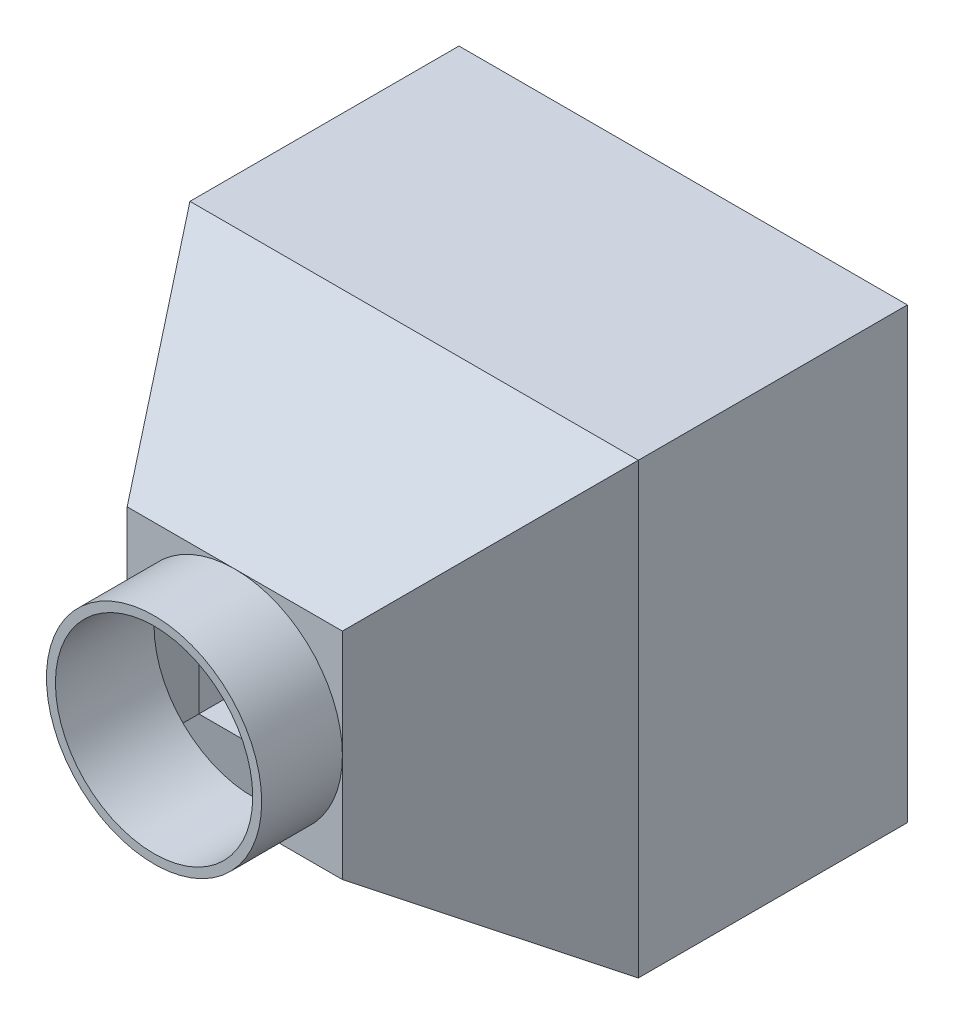
from build123d import *

# Parameters (mm, degrees)
SKETCH_1_W           = 50
SKETCH_1_H           = 50
EXTRUDE_1_DEPTH      = 50
SKETCH_6_R           = 12
SKETCH_6_R_2         = 11
EXTRUDE_3_DEPTH      = 9
CUT_EXTRUDE_5_REACH  = 83.277
CUT_EXTRUDE_6_REACH  = 83.277
SKETCH_20_W          = 48
SKETCH_20_H          = 48
CUT_EXTRUDE_7_DEPTH  = 30
CUT_EXTRUDE_START    = -29
SKETCH_21_R          = 11
CUT_EXTRUDE_9_DEPTH  = 29
SKETCH_28_W          = 48
SKETCH_28_H          = 48
CUT_EXTRUDE_11_DEPTH = 18
CUT_EXTRUDE_11_DRAFT = -33


with BuildPart() as part:
    # Эскиз1 → Бобышка-Вытянуть1 (new body)
    with BuildSketch(Plane.XY):
        Rectangle(SKETCH_1_W, SKETCH_1_H)
    extrude(amount=EXTRUDE_1_DEPTH)

    # Эскиз6 → Бобышка-Вытянуть3 (add)
    with BuildSketch(Plane.XY.offset(50)):
        Circle(SKETCH_6_R)
        Circle(SKETCH_6_R_2, mode=Mode.SUBTRACT)
    extrude(amount=EXTRUDE_3_DEPTH)

    # Вырез-Вытянуть5: up to this face of the body (flat: up to its plane)
    cut_extrude_5_end = Plane(part.part.faces().sort_by_distance((0, 25, 25))[0])
    # Эскиз19 → Вырез-Вытянуть5 (cut, up to the picked face)
    with BuildSketch(Plane.XZ.offset(25), mode=Mode.PRIVATE) as cut_extrude_5_sk1:
        Polygon((-12, 50), (-25, 50), (-25, 30), align=None)
    cut_extrude_5_tool1 = split(extrude(cut_extrude_5_sk1.sketch, amount=-CUT_EXTRUDE_5_REACH, mode=Mode.PRIVATE), bisect_by=cut_extrude_5_end, keep=Keep.BOTH, mode=Mode.PRIVATE)
    # Эскиз19 → Вырез-Вытянуть5 (cut, up to the picked face)
    with BuildSketch(Plane.XZ.offset(25), mode=Mode.PRIVATE) as cut_extrude_5_sk2:
        Polygon((12, 50), (25, 50), (25, 30), align=None)
    cut_extrude_5_tool2 = split(extrude(cut_extrude_5_sk2.sketch, amount=-CUT_EXTRUDE_5_REACH, mode=Mode.PRIVATE), bisect_by=cut_extrude_5_end, keep=Keep.BOTH, mode=Mode.PRIVATE)
    add(cut_extrude_5_tool1.solids().sort_by(Axis((-20.666667, -25, 43.333333), (0, 1, 0)))[0], mode=Mode.SUBTRACT)
    add(cut_extrude_5_tool2.solids().sort_by(Axis((20.666667, -25, 43.333333), (0, 1, 0)))[0], mode=Mode.SUBTRACT)

    # Вырез-Вытянуть6: up to this face of the body (flat: up to its plane)
    cut_extrude_6_end = Plane(part.part.faces().sort_by_distance((-25, 0, 15))[0])
    # Эскиз18 → Вырез-Вытянуть6 (cut, up to the picked face)
    with BuildSketch(Plane(origin=(25, 0, 0), x_dir=(0, 0, -1), z_dir=(1, 0, 0)), mode=Mode.PRIVATE) as cut_extrude_6_sk1:
        Polygon((-50, 12), (-50, 25), (-30, 25), align=None)
    cut_extrude_6_tool1 = split(extrude(cut_extrude_6_sk1.sketch, amount=-CUT_EXTRUDE_6_REACH, mode=Mode.PRIVATE), bisect_by=cut_extrude_6_end, keep=Keep.BOTH, mode=Mode.PRIVATE)
    # Эскиз18 → Вырез-Вытянуть6 (cut, up to the picked face)
    with BuildSketch(Plane(origin=(25, 0, 0), x_dir=(0, 0, -1), z_dir=(1, 0, 0)), mode=Mode.PRIVATE) as cut_extrude_6_sk2:
        Polygon((-50, -12), (-50, -25), (-30, -25), align=None)
    cut_extrude_6_tool2 = split(extrude(cut_extrude_6_sk2.sketch, amount=-CUT_EXTRUDE_6_REACH, mode=Mode.PRIVATE), bisect_by=cut_extrude_6_end, keep=Keep.BOTH, mode=Mode.PRIVATE)
    add(cut_extrude_6_tool1.solids().sort_by(Axis((25, 20.666667, 43.333333), (-1, 0, 0)))[0], mode=Mode.SUBTRACT)
    add(cut_extrude_6_tool2.solids().sort_by(Axis((25, -20.666667, 43.333333), (-1, 0, 0)))[0], mode=Mode.SUBTRACT)

    # Эскиз20 → Вырез-Вытянуть7 (cut)
    with BuildSketch(Plane(origin=(0, 0, 0), x_dir=(-1, 0, 0), z_dir=(0, 0, -1))):
        Rectangle(SKETCH_20_W, SKETCH_20_H)
    extrude(amount=-CUT_EXTRUDE_7_DEPTH, mode=Mode.SUBTRACT)

    # Эскиз21 → Вырез-Вытянуть9 (cut)
    with BuildSketch(Plane.XY.offset(59).offset(CUT_EXTRUDE_START)):
        Circle(SKETCH_21_R)
    extrude(amount=CUT_EXTRUDE_9_DEPTH, mode=Mode.SUBTRACT)


with BuildPart() as cut_extrude_11_tool:
    # Эскиз28 → Вырез-Вытянуть11 (with draft: the straight prism first)
    with BuildSketch(Plane(origin=(0, 0, 30), x_dir=(-1, 0, 0), z_dir=(0, 0, -1))):
        Rectangle(SKETCH_28_W, SKETCH_28_H)
    extrude(amount=-CUT_EXTRUDE_11_DEPTH)
    # Вырез-Вытянуть11: the draft: its side faces are tilted about the plane it starts from
    cut_extrude_11_sides = [cut_extrude_11_tool.faces().sort_by_distance(p)[0] for p in [
        (24, 0, 39),
        (0, -24, 39),
        (-24, 0, 39),
        (0, 24, 39),
    ]]
    draft(cut_extrude_11_sides, Plane(origin=(0, 0, 30), x_dir=(-1, 0, 0), z_dir=(0, 0, -1)), CUT_EXTRUDE_11_DRAFT)


with BuildPart() as part_1:
    add(part.part)

    # Вырез-Вытянуть11: cut by cut_extrude_11_tool
    add(cut_extrude_11_tool.part, mode=Mode.SUBTRACT)


solid = part_1.part
